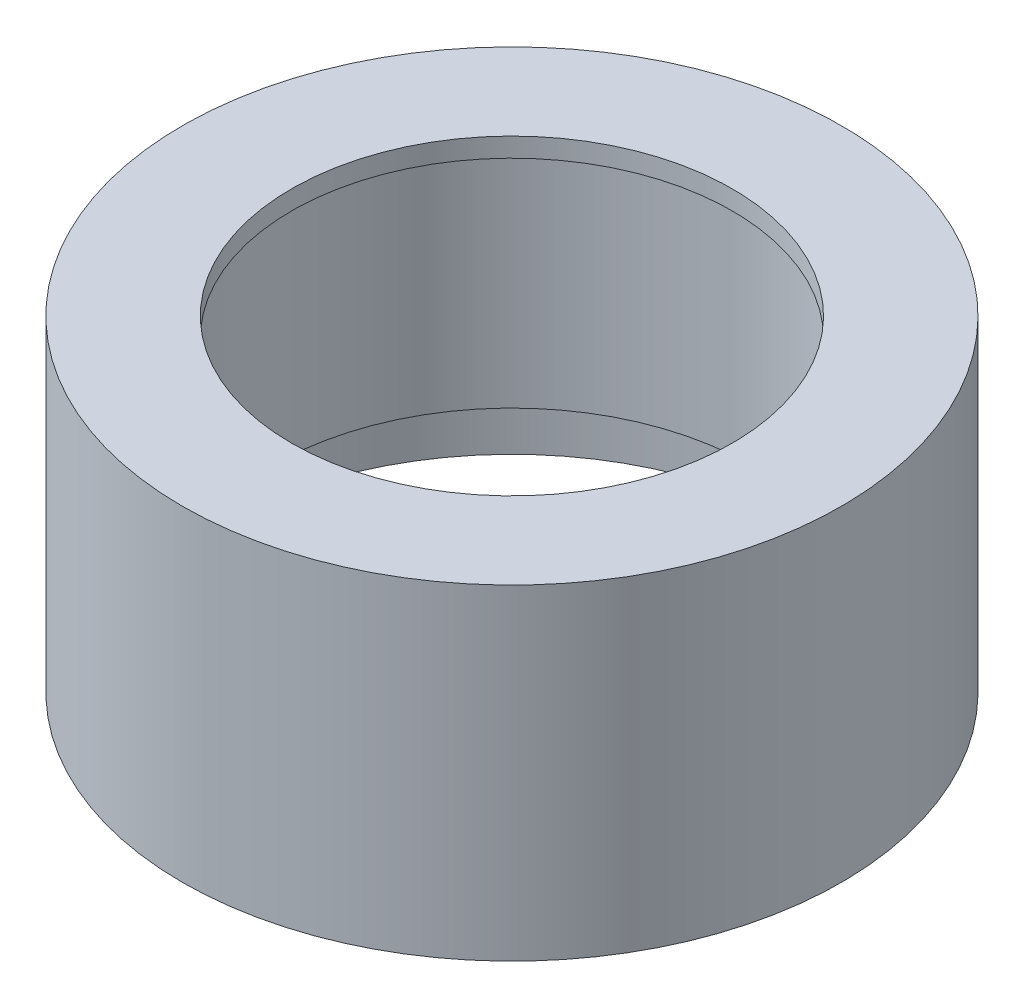
from build123d import *

# Parameters (mm, degrees)
SKETCH1_R           = 8.6
SKETCH1_R_2         = 7.6
BOSS_EXTRUDE1_DEPTH = 2
SKETCH2_R           = 8.6
SKETCH2_R_2         = 6.25
BOSS_EXTRUDE2_DEPTH = 6
SKETCH3_R           = 8.6
SKETCH3_R_2         = 5.75
BOSS_EXTRUDE3_DEPTH = 0.5


with BuildPart() as part:
    # Sketch1 → Boss-Extrude1 (new body)
    with BuildSketch(Plane(origin=(0, 0, 0), x_dir=(1, 0, 0), z_dir=(0, 1, 0))):
        with Locations(Location((0, 0, 0), (0, 0, 270))):
            Circle(SKETCH1_R)
        with Locations(Location((0, 0, 0), (0, 0, 270))):
            Circle(SKETCH1_R_2, mode=Mode.SUBTRACT)
    extrude(amount=BOSS_EXTRUDE1_DEPTH)

    # Sketch2 → Boss-Extrude2 (add)
    with BuildSketch(Plane(origin=(0, 2, 0), x_dir=(1, 0, 0), z_dir=(0, 1, 0))):
        with Locations(Location((0, 0, 0), (0, 0, 270))):
            Circle(SKETCH2_R)
        with Locations(Location((0, 0, 0), (0, 0, 270))):
            Circle(SKETCH2_R_2, mode=Mode.SUBTRACT)
    extrude(amount=BOSS_EXTRUDE2_DEPTH)

    # Sketch3 → Boss-Extrude3 (add)
    with BuildSketch(Plane(origin=(0, 8, 0), x_dir=(1, 0, 0), z_dir=(0, 1, 0))):
        with Locations(Location((0, 0, 0), (0, 0, 270))):
            Circle(SKETCH3_R)
        with Locations(Location((0, 0, 0), (0, 0, 270))):
            Circle(SKETCH3_R_2, mode=Mode.SUBTRACT)
    extrude(amount=BOSS_EXTRUDE3_DEPTH)


solid = part.part
